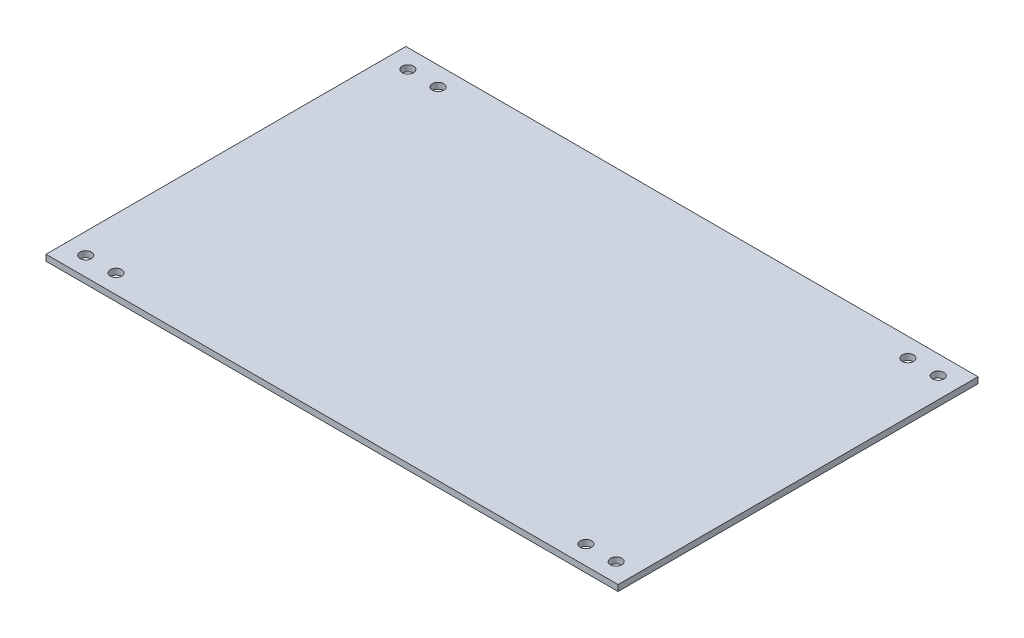
from build123d import *

# Parameters (mm, degrees)
SKETCH_1_W          = 151
SKETCH_1_H          = 95
EXTRUDE_1_DEPTH     = 1.6
SKETCH_2_R          = 1.5
CUT_EXTRUDE_1_DEPTH = 179.405605293


with BuildPart() as part:
    # 草图1 → 凸台-拉伸1 (new body)
    with BuildSketch(Plane(origin=(0, 0, 0), x_dir=(1, 0, 0), z_dir=(0, 1, 0))):
        with Locations((75.5, 47.5)):
            Rectangle(SKETCH_1_W, SKETCH_1_H)
    extrude(amount=EXTRUDE_1_DEPTH)

    # 草图2 → 切除-拉伸1 (cut, through all)
    with BuildSketch(Plane(origin=(0, 1.6, 0), x_dir=(1, 0, 0), z_dir=(0, 1, 0))):
        with Locations(Location((5.5, 90, 0), (0, 0, 270))):
            Circle(SKETCH_2_R)
        with Locations(Location((145.5, 90, 0), (0, 0, 90))):
            Circle(SKETCH_2_R)
        with Locations(Location((145.5, 5, 0), (0, 0, 270))):
            Circle(SKETCH_2_R)
        with Locations(Location((5.5, 5, 0), (0, 0, 90))):
            Circle(SKETCH_2_R)
        with Locations(Location((13.5, 90, 0), (0, 0, 270))):
            Circle(SKETCH_2_R)
        with Locations(Location((13.5, 5, 0), (0, 0, 90))):
            Circle(SKETCH_2_R)
        with Locations(Location((137.5, 5, 0), (0, 0, 270))):
            Circle(SKETCH_2_R)
        with Locations(Location((137.5, 90, 0), (0, 0, 90))):
            Circle(SKETCH_2_R)
    extrude(amount=-CUT_EXTRUDE_1_DEPTH, mode=Mode.SUBTRACT)


solid = part.part
